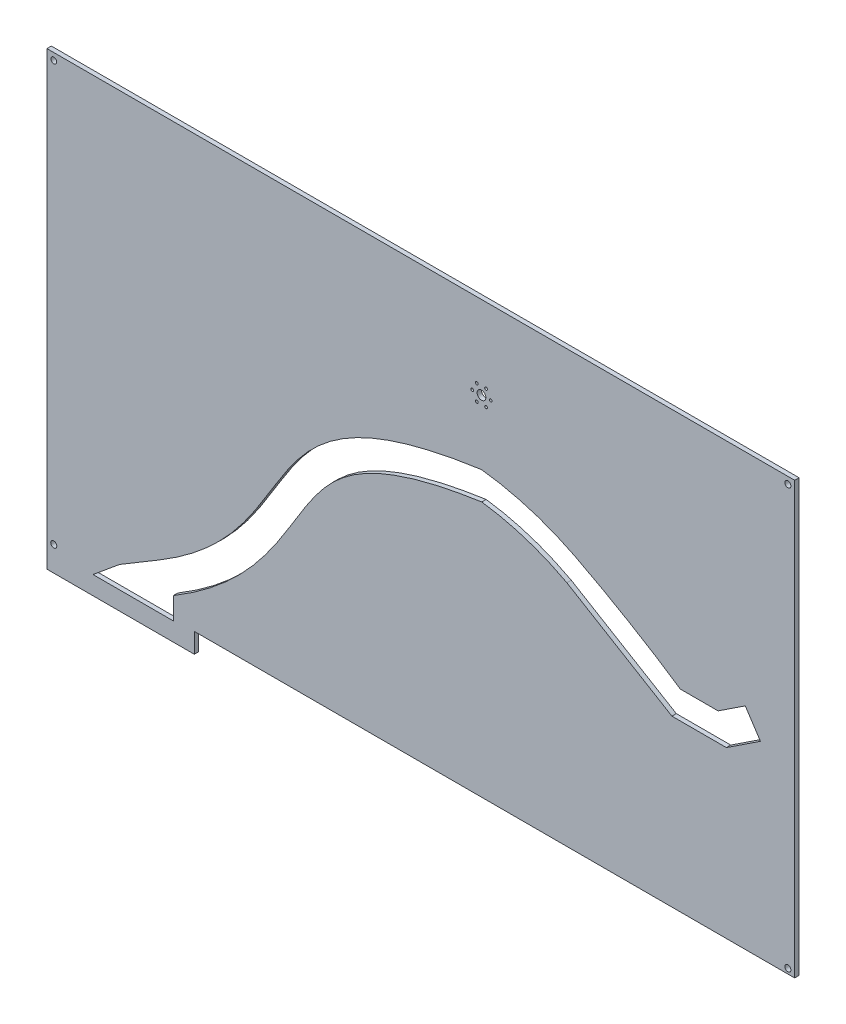
from build123d import *

# Parameters (mm, degrees)
SKETCH1_R           = 3.292374312
SKETCH1_R_2         = 3.294421934
SKETCH1_R_3         = 3.163533699
SKETCH1_R_4         = 1.5
SKETCH1_R_5         = 4.7625
BOSS_EXTRUDE1_DEPTH = 4.7625


with BuildPart() as part:
    # Sketch1 → Boss-Extrude1 (new body)
    with BuildSketch(Plane.XY):
        Polygon((-436.816755826, -147.994392447), (-436.816755826, -169.55039994), (-596.816755826, -169.55039994), (-596.816755826, -150), (-596.816755826, 320), (215.080766979, 320), (215.080766979, -147.994392447), align=None)
        with Locations(Location((-589.375723826, -142.5578, 0), (0, 0, 180))):
            Circle(SKETCH1_R, mode=Mode.SUBTRACT)
        with Locations(Location((207.642212326, -142.5578, 0), (0, 0, 180))):
            Circle(SKETCH1_R, mode=Mode.SUBTRACT)
        with Locations(Location((207.642212326, 312.5578, 0), (0, 0, 180))):
            Circle(SKETCH1_R_2, mode=Mode.SUBTRACT)
        with Locations(Location((-589.375723826, 312.5578, 0), (0, 0, 180))):
            Circle(SKETCH1_R_3, mode=Mode.SUBTRACT)
        with Locations(Location((-135, 230, 0), (0, 0, 180))):
            Circle(SKETCH1_R_4, mode=Mode.SUBTRACT)
        with Locations(Location((-130, 238.660254038, 0), (0, 0, 180))):
            Circle(SKETCH1_R_4, mode=Mode.SUBTRACT)
        with Locations(Location((-120, 238.660254038, 0), (0, 0, 180))):
            Circle(SKETCH1_R_4, mode=Mode.SUBTRACT)
        with Locations(Location((-115, 230, 0), (0, 0, 180))):
            Circle(SKETCH1_R_4, mode=Mode.SUBTRACT)
        with Locations(Location((-120, 221.339745962, 0), (0, 0, 180))):
            Circle(SKETCH1_R_4, mode=Mode.SUBTRACT)
        with Locations(Location((-130, 221.339745962, 0), (0, 0, 180))):
            Circle(SKETCH1_R_4, mode=Mode.SUBTRACT)
        with Locations(Location((-125, 230, 0), (0, 0, 180))):
            Circle(SKETCH1_R_5, mode=Mode.SUBTRACT)
        with BuildLine():
            Line((-475, -100), (-518.031074044, -125.74437106))
            Line((-518.031074044, -125.74437106), (-546.780363752, -149.55039994))
            Line((-546.780363752, -149.55039994), (-459.597813184, -149.55039994))
            Line((-459.597813184, -149.55039994), (-459.597813184, -125.74437106))
            add(Edge.make_bspline(
                [(-459.597813184, -125.74437106), (-458.129207209, -124.865742348), (-455.185829054, -123.081513508), (-449.471359557, -119.524654219), (-442.555549408, -115.046151368), (-434.636214281, -109.639746192), (-424.556425744, -102.386073958), (-412.829398694, -93.24529863), (-400.055778993, -82.1905419), (-388.486450966, -71.092190732), (-374.537420018, -56.304576734), (-359.620141336, -37.979207276), (-344.890774823, -16.767556206), (-332.340078528, 3.245699555), (-321.055163892, 21.796443272), (-310.225956981, 38.664819129), (-299.079604806, 53.834809894), (-286.812791685, 67.514642691), (-272.431751915, 80.088460877), (-257.652665703, 89.924055398), (-243.498210685, 97.442015492), (-231.565093385, 102.886615769), (-218.172694067, 108.112662921), (-203.190999217, 113.087836875), (-189.281720356, 116.996077726), (-177.243425929, 119.962936855), (-167.745823902, 122.104113686), (-157.766000623, 124.157339904), (-149.036898589, 125.791853127), (-141.799270328, 127.051772068), (-136.243143266, 127.972296195), (-131.502167372, 128.719120718), (-127.648712651, 129.303231945), (-125.690331117, 129.592450023), (-124.714693771, 129.734664734)],
                knots=[0, 0, 0, 0, 0.00777259, 0.01554518, 0.03109036, 0.04663554, 0.062180721, 0.093271081, 0.124361441, 0.155451801, 0.186542162, 0.248722882, 0.310903603, 0.373084323, 0.435265044, 0.497445764, 0.559626485, 0.621807206, 0.683987926, 0.746168647, 0.777259007, 0.808349367, 0.839439728, 0.870530088, 0.901620448, 0.917165628, 0.932710808, 0.948255989, 0.963801169, 0.971573759, 0.979346349, 0.987118939, 0.991005234, 0.994891529, 0.994891529, 0.994891529, 0.994891529], degree=3))
            ThreePointArc((-124.714693771, 129.734664734), (-77.172123272, 119.052933104), (-32.323699215, 100))
            Line((-32.323699215, 100), (81.77450832, 31.56416045))
            Line((81.77450832, 31.56416045), (140.88780849, 31.56416045))
            Line((140.88780849, 31.56416045), (177.923308763, 55.973921994))
            Line((177.923308763, 55.973921994), (161.413907899, 81.022668132))
            Line((161.413907899, 81.022668132), (131.890654865, 61.56416045))
            Line((131.890654865, 61.56416045), (90.97120992, 61.56416045))
            ThreePointArc((90.97120992, 61.56416045), (35.57180112, 96.520479224), (-21.701372103, 128.313911667))
            Line((-21.701372103, 128.313911667), (-25, 130))
            ThreePointArc((-25, 130), (-73.684930832, 149.383563894), (-125, 160))
            add(Edge.make_bspline(
                [(-475, -100), (-419.540575809, -66.820070684), (-329.590802121, 43.11603253), (-307.635554762, 134.287094016), (-125, 160)],
                knots=[0, 0, 0, 0, 0.312223899, 1, 1, 1, 1], degree=3))
        make_face(mode=Mode.SUBTRACT)
    extrude(amount=BOSS_EXTRUDE1_DEPTH)


solid = part.part
